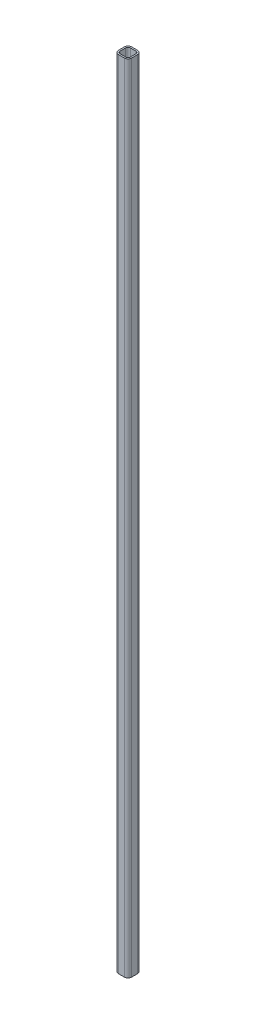
from build123d import *

# Parameters (mm, degrees)
EXTRUDE_1_DEPTH      = 1100
EXTRUDE_1_DEPTH_BACK = 90
SKETCH_1_W           = 22
SKETCH_1_H           = 22
SKETCH_2_W           = 22
SKETCH_2_H           = 22
EXTRUDE_2_DEPTH      = 130
SKETCH1_W            = 17
SKETCH1_H            = 17
CUT_EXTRUDE1_DEPTH   = 1321.091663484
FILLET2_R            = 6
FILLET3_R            = 4


with BuildPart() as part:
    # Эскиз1 → Бобышка-Вытянуть1 (new, two sides: drawn at the far end of the back side and taken through both)
    with BuildSketch(Plane(origin=(0, 0, 0), x_dir=(1, 0, 0), z_dir=(0, 1, 0)).offset(-EXTRUDE_1_DEPTH_BACK)):
        Rectangle(SKETCH_1_W, SKETCH_1_H)
    extrude(amount=EXTRUDE_1_DEPTH + EXTRUDE_1_DEPTH_BACK)

    # Эскиз2 → Бобышка-Вытянуть2 (add)
    with BuildSketch(Plane.XZ.offset(90)):
        Rectangle(SKETCH_2_W, SKETCH_2_H)
    extrude(amount=EXTRUDE_2_DEPTH)

    # Sketch1 → Cut-Extrude1 (cut, through all)
    with BuildSketch(Plane.XZ.offset(220)):
        Rectangle(SKETCH1_W, SKETCH1_H)
    extrude(amount=-CUT_EXTRUDE1_DEPTH, mode=Mode.SUBTRACT)

    # Fillet2
    fillet2_edges = [part.edges().sort_by_distance(p)[0] for p in [
        (11, 440, 11),
        (-11, 440, 11),
        (-11, 440, -11),
        (11, 440, -11),
    ]]
    fillet(fillet2_edges, radius=FILLET2_R)

    # Fillet3
    fillet3_edges = [part.edges().sort_by_distance(p)[0] for p in [
        (8.5, 440, 8.5),
        (8.5, 440, -8.5),
        (-8.5, 440, -8.5),
        (-8.5, 440, 8.5),
    ]]
    fillet(fillet3_edges, radius=FILLET3_R)


solid = part.part
